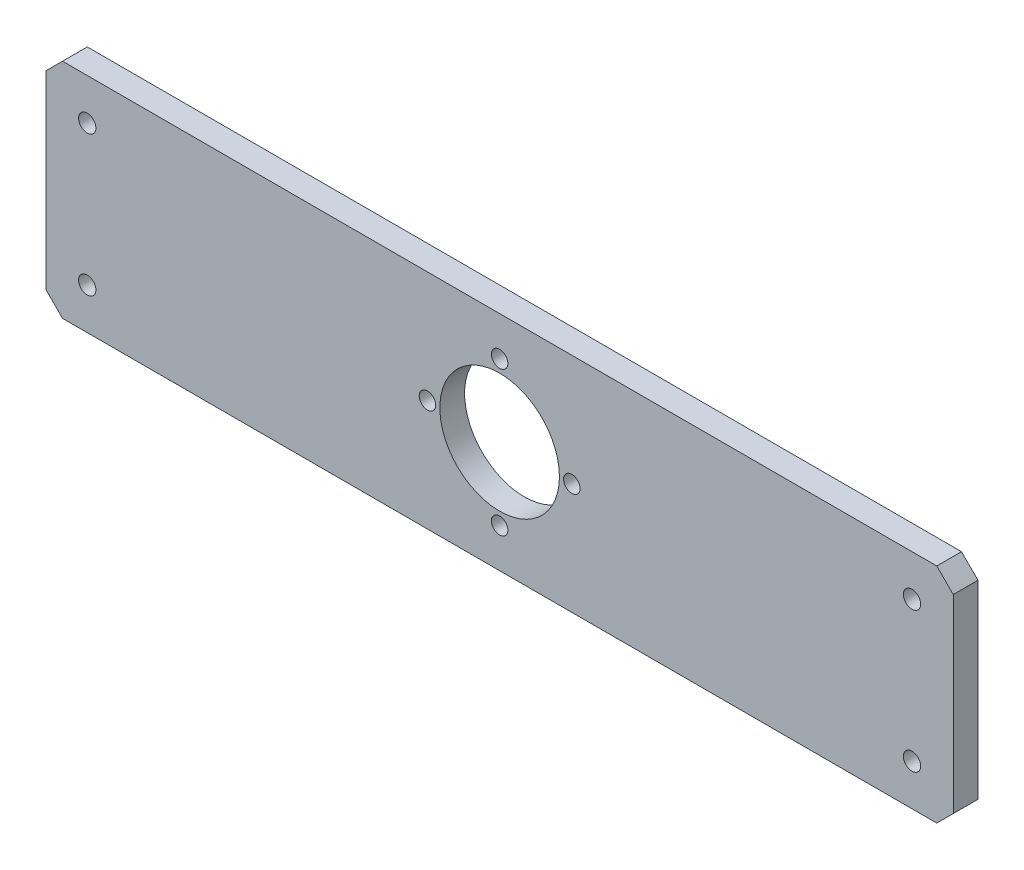
from build123d import *

# Parameters (mm, degrees)
SKETCH_1_W      = 220
SKETCH_1_H      = 54
SKETCH_1_R      = 2.1
SKETCH_1_R_2    = 2
SKETCH_1_R_3    = 14.5
EXTRUDE_1_DEPTH = 3
CHAMFER_1_SIZE  = 4


with BuildPart() as part:
    # 草图1 → 凸台-拉伸1 (new, symmetric)
    with BuildSketch(Plane.XY):
        Rectangle(SKETCH_1_W, SKETCH_1_H)
        with Locations((-100, 17)):
            Circle(SKETCH_1_R, mode=Mode.SUBTRACT)
        with Locations((-100, -17)):
            Circle(SKETCH_1_R, mode=Mode.SUBTRACT)
        with Locations((100, 17)):
            Circle(SKETCH_1_R, mode=Mode.SUBTRACT)
        with Locations((100, -17)):
            Circle(SKETCH_1_R, mode=Mode.SUBTRACT)
        with Locations((0, 17.5)):
            Circle(SKETCH_1_R_2, mode=Mode.SUBTRACT)
        Circle(SKETCH_1_R_3, mode=Mode.SUBTRACT)
        with Locations((17.5, 0)):
            Circle(SKETCH_1_R_2, mode=Mode.SUBTRACT)
        with Locations((0, -17.5)):
            Circle(SKETCH_1_R_2, mode=Mode.SUBTRACT)
        with Locations((-17.5, 0)):
            Circle(SKETCH_1_R_2, mode=Mode.SUBTRACT)
    extrude(amount=EXTRUDE_1_DEPTH, both=True)

    # 倒角1
    chamfer_1_edges = [part.edges().sort_by_distance(p)[0] for p in [
        (-110, 27, 0),
        (110, 27, 0),
        (110, -27, 0),
        (-110, -27, 0),
    ]]
    chamfer(chamfer_1_edges, length=CHAMFER_1_SIZE)


solid = part.part
